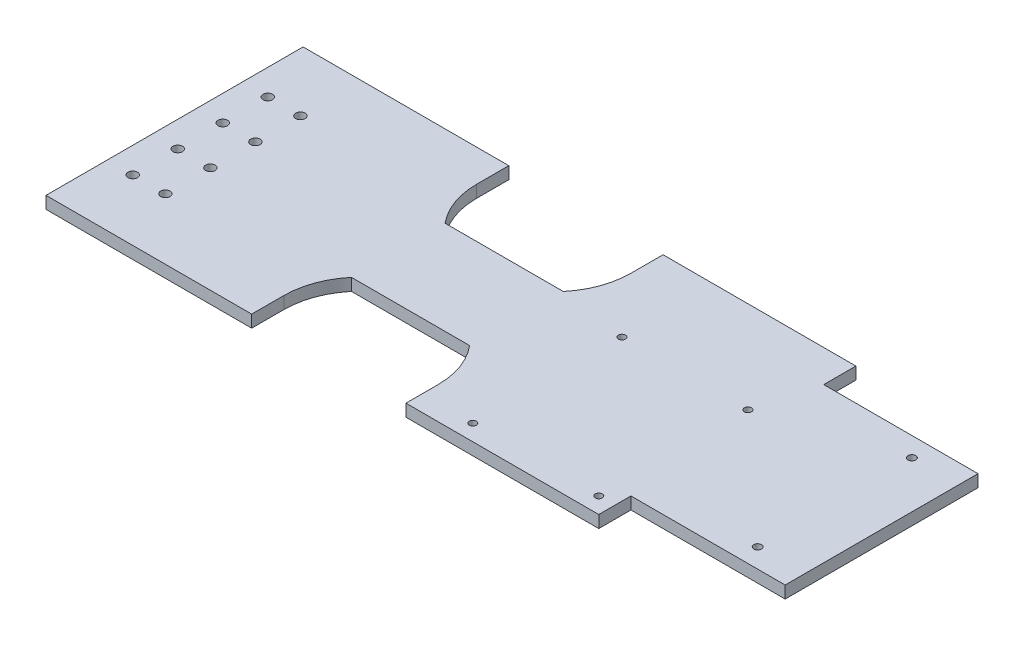
from build123d import *

# Parameters (mm, degrees)
SKETCH1_W           = 275
SKETCH1_H           = 100
BOSS_EXTRUDE4_DEPTH = 4.75
SKETCH3_R           = 1.5
SKETCH3_W           = 60
SKETCH3_H           = 12.5
CUT_EXTRUDE1_DEPTH  = 10
SKETCH4_R           = 1.85
SKETCH4_R_2         = 1.375
CUT_EXTRUDE2_DEPTH  = 10


with BuildPart() as part:
    # Sketch1 → Boss-Extrude4 (new body)
    with BuildSketch(Plane(origin=(0, 0, 0), x_dir=(1, 0, 0), z_dir=(0, 1, 0))):
        Rectangle(SKETCH1_W, SKETCH1_H)
    extrude(amount=BOSS_EXTRUDE4_DEPTH)

    # Sketch3 → Cut-Extrude1 (cut)
    with BuildSketch(Plane(origin=(0, 4.75, 0), x_dir=(1, 0, 0), z_dir=(0, 1, 0))):
        with Locations(Location((119.3, -30, 0), (0, 0, 270))):
            Circle(SKETCH3_R)
        with Locations(Location((119.3, 30, 0), (0, 0, 270))):
            Circle(SKETCH3_R)
        with Locations((107.5, -43.75)):
            Rectangle(SKETCH3_W, SKETCH3_H)
        with Locations((107.5, 43.75)):
            Rectangle(SKETCH3_W, SKETCH3_H)
        with BuildLine():
            Line((2.5, -50), (-57.5, -50))
            Line((-57.5, -50), (-57.5, -37.5))
            ThreePointArc((-57.5, -37.5), (-55.690778624, -27.2393957), (-50.481333294, -18.216371709))
            Line((-50.481333294, -18.216371709), (-4.518666706, -18.216371709))
            ThreePointArc((-4.518666706, -18.216371709), (0.690778624, -27.2393957), (2.5, -37.5))
            Line((2.5, -37.5), (2.5, -50))
        make_face()
        with BuildLine():
            Line((2.5, 50), (-57.5, 50))
            Line((-57.5, 50), (-57.5, 37.5))
            ThreePointArc((-57.5, 37.5), (-55.690778624, 27.2393957), (-50.481333294, 18.216371709))
            Line((-50.481333294, 18.216371709), (-4.518666706, 18.216371709))
            ThreePointArc((-4.518666706, 18.216371709), (0.690778624, 27.2393957), (2.5, 37.5))
            Line((2.5, 37.5), (2.5, 50))
        make_face()
    extrude(amount=-CUT_EXTRUDE1_DEPTH, mode=Mode.SUBTRACT)

    # Sketch4 → Cut-Extrude2 (cut)
    with BuildSketch(Plane(origin=(0, 4.75, 0), x_dir=(1, 0, 0), z_dir=(0, 1, 0))):
        with Locations(Location((-127.5, -26.25, 0), (0, 0, 270))):
            Circle(SKETCH4_R)
        with Locations(Location((-114.8, -26.25, 0), (0, 0, 270))):
            Circle(SKETCH4_R)
        with Locations(Location((-127.5, -8.75, 0), (0, 0, 270))):
            Circle(SKETCH4_R)
        with Locations(Location((-114.8, -8.75, 0), (0, 0, 270))):
            Circle(SKETCH4_R)
        with Locations(Location((-114.8, 8.75, 0), (0, 0, 270))):
            Circle(SKETCH4_R)
        with Locations(Location((-127.5, 8.75, 0), (0, 0, 270))):
            Circle(SKETCH4_R)
        with Locations(Location((-114.8, 26.25, 0), (0, 0, 270))):
            Circle(SKETCH4_R)
        with Locations(Location((-127.5, 26.25, 0), (0, 0, 270))):
            Circle(SKETCH4_R)
        with Locations(Location((71.25, -43.75, 0), (0, 0, 270))):
            Circle(SKETCH4_R_2)
        with Locations(Location((22.25, -43.75, 0), (0, 0, 270))):
            Circle(SKETCH4_R_2)
        with Locations(Location((71.25, 14.25, 0), (0, 0, 270))):
            Circle(SKETCH4_R_2)
        with Locations(Location((22.25, 14.25, 0), (0, 0, 270))):
            Circle(SKETCH4_R_2)
    extrude(amount=-CUT_EXTRUDE2_DEPTH, mode=Mode.SUBTRACT)


solid = part.part
